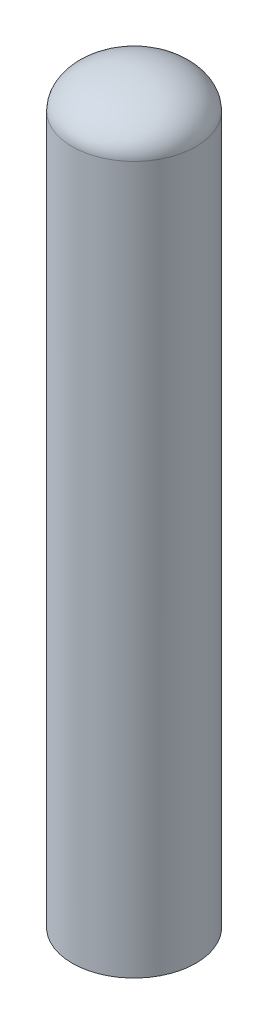
from build123d import *

# Parameters (mm, degrees)
SKETCH1_R           = 44.45
SKETCH1_R_2         = 38.1
BOSS_EXTRUDE1_DEPTH = 508


with BuildPart() as part:
    # Sketch1 → Boss-Extrude1 (new body)
    with BuildSketch(Plane(origin=(0, 0, 0), x_dir=(1, 0, 0), z_dir=(0, 1, 0))):
        with Locations(Location((0, 0, 0), (0, 0, 270))):
            Circle(SKETCH1_R)
        with Locations(Location((0, 0, 0), (0, 0, 270))):
            Circle(SKETCH1_R_2, mode=Mode.SUBTRACT)
    extrude(amount=BOSS_EXTRUDE1_DEPTH)


with BuildPart() as body_2:
    # Sketch3 → Revolve1 (revolve)
    with BuildSketch(Plane.XY):
        with BuildLine():
            Line((0, 527.05), (0, 533.4))
            add(Edge.make_bspline(
                [(44.45, 508), (44.45, 533.4), (0, 533.4)],
                knots=[3.141592654, 3.141592654, 3.141592654, 4.71238898, 4.71238898, 4.71238898], degree=2, weights=[1, 0.707106781, 1]))
            Line((44.45, 508), (38.1, 508))
            add(Edge.make_bspline(
                [(0, 527.05), (2.705238138, 526.962603339), (8.16431522, 526.498297406), (15.910970109, 524.977430938), (22.919684869, 522.719322608), (28.844838794, 519.872132288), (33.407449824, 516.657966083), (36.416865038, 513.387356249), (37.655833073, 510.939796686), (38.066087901, 509.213893903), (38.113248081, 508.410075327), (38.1, 508)],
                knots=[0, 0, 0, 0, 0.196349541, 0.392699082, 0.589048623, 0.785398163, 0.981747704, 1.178097245, 1.374446786, 1.472621556, 1.570796327, 1.570796327, 1.570796327, 1.570796327], degree=3))
        make_face()
    revolve(axis=Axis((0, 527.05, 0), (0, 1, 0)))

    # Combine1: union part
    add(part.part)


solid = body_2.part
